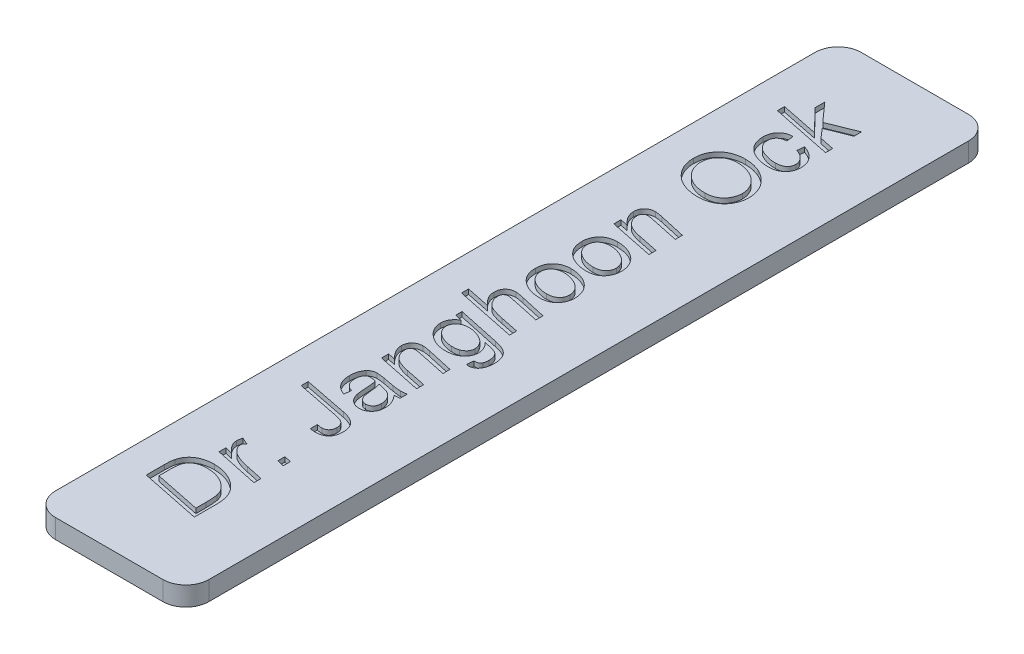
from build123d import *

# Parameters (mm, degrees)
BOSS_EXTRUDE1_DEPTH      = 66.675
BOSS_EXTRUDE1_DEPTH_BACK = 66.675
SKETCH3_W                = 25.4
SKETCH3_H                = 3.175
SKETCH5_OUTSIDE_W        = 54.556
SKETCH5_OUTSIDE_H        = 162.506
CUT_EXTRUDE2_DEPTH       = 68.947967225
CUT_EXTRUDE1_DEPTH       = 0.79375


with BuildPart() as part:
    # Sketch3 → Boss-Extrude1 (new, two sides: drawn at the far end of the back side and taken through both)
    with BuildSketch(Plane.XY.offset(-BOSS_EXTRUDE1_DEPTH_BACK)):
        Rectangle(SKETCH3_W, SKETCH3_H)
    extrude(amount=BOSS_EXTRUDE1_DEPTH + BOSS_EXTRUDE1_DEPTH_BACK)

    # Sketch5 outside → Cut-Extrude2 (cut, through all)
    with BuildSketch(Plane(origin=(0, 1.5875, 0), x_dir=(1, 0, 0), z_dir=(0, 1, 0))):
        Rectangle(SKETCH5_OUTSIDE_W, SKETCH5_OUTSIDE_H)
        with BuildLine():
            Line((12.7, -62.865), (12.7, 62.865))
            ThreePointArc((12.7, 62.865), (11.584076836, 65.559076836), (8.89, 66.675))
            Line((8.89, 66.675), (-8.89, 66.675))
            ThreePointArc((-8.89, 66.675), (-11.584076836, 65.559076836), (-12.7, 62.865))
            Line((-12.7, 62.865), (-12.7, -62.865))
            ThreePointArc((-12.7, -62.865), (-11.584076836, -65.559076836), (-8.89, -66.675))
            Line((-8.89, -66.675), (8.89, -66.675))
            ThreePointArc((8.89, -66.675), (11.584076836, -65.559076836), (12.7, -62.865))
        make_face(mode=Mode.SUBTRACT)
    extrude(amount=-CUT_EXTRUDE2_DEPTH, mode=Mode.SUBTRACT)

    # Sketch4 → Cut-Extrude1 (cut)
    # profile 1 of 14: a face of its own
    with BuildSketch(Plane(origin=(0, 1.5875, 0), x_dir=(1, 0, 0), z_dir=(0, 1, 0))):
        with BuildLine():
            Line((2.54, -55.128205128), (-7.46, -53.076923077))
            Line((-7.46, -53.076923077), (-7.46, -50.086137821))
            add(Edge.make_bspline(
                [(-7.46, -50.086137821), (-7.45984679, -49.99932217), (-7.459548547, -49.830324567), (-7.450628106, -49.585259722), (-7.439948376, -49.355355382), (-7.420380804, -49.142538387), (-7.402681558, -48.944289881), (-7.37339821, -48.762856641), (-7.342498106, -48.596212545), (-7.316265859, -48.491477372), (-7.30375, -48.44150641)],
                knots=[0, 0, 0, 0, 1.257835162, 2.448534655, 3.553053336, 4.59197352, 5.545083296, 6.435900553, 7.253741116, 8, 8, 8, 8], degree=3))
            add(Edge.make_bspline(
                [(-7.30375, -48.44150641), (-7.264998295, -48.310104018), (-7.18851271, -48.050750556), (-7.017709813, -47.687016253), (-6.807602242, -47.352185413), (-6.555874224, -47.048998786), (-6.266589713, -46.777660468), (-5.941646688, -46.542512847), (-5.584090023, -46.342580903), (-5.193365919, -46.181656045), (-4.774161856, -46.053567365), (-4.328903398, -45.962175127), (-3.858953383, -45.907209729), (-3.537875923, -45.900745857), (-3.373461538, -45.897435897)],
                knots=[0, 0, 0, 0, 0.971590842, 1.917662557, 2.842394273, 3.771793656, 4.707640625, 5.651249923, 6.612793886, 7.609543753, 8.645876517, 9.720784653, 10.832880426, 12, 12, 12, 12], degree=3))
            add(Edge.make_bspline(
                [(-3.373461538, -45.897435897), (-3.176940373, -45.901339899), (-2.791350101, -45.908999862), (-2.226265685, -45.97890124), (-1.687708416, -46.091896878), (-1.177495048, -46.252143325), (-0.695954697, -46.446012378), (-0.242926887, -46.669554868), (0.181067888, -46.918739682), (0.569448045, -47.197968419), (0.92483136, -47.490496691), (1.242239315, -47.792520822), (1.519128415, -48.102156329), (1.756689512, -48.422516984), (1.961579805, -48.760191031), (2.130416822, -49.126039248), (2.27649039, -49.518831106), (2.347494433, -49.794921946), (2.38375, -49.935897436)],
                knots=[0, 0, 0, 0, 1.243603744, 2.440050186, 3.598221513, 4.722608029, 5.820730142, 6.881240689, 7.917895811, 8.930133465, 9.905945135, 10.829761846, 11.701023769, 12.532064915, 13.351228406, 14.19647787, 15.07909869, 16, 16, 16, 16], degree=3))
            add(Edge.make_bspline(
                [(2.38375, -49.935897436), (2.407986878, -50.051813726), (2.458964214, -50.295620028), (2.507030761, -50.683954942), (2.534283451, -51.110706684), (2.538039304, -51.407541215), (2.54, -51.5625)],
                knots=[0, 0, 0, 0, 0.867572468, 1.824761937, 2.864443951, 4, 4, 4, 4], degree=3))
            Line((2.54, -51.5625), (2.54, -55.128205128))
        make_face()
        with BuildLine():
            Line((1.386153846, -53.717948718), (1.386153846, -52.067307692))
            add(Edge.make_bspline(
                [(1.386153846, -52.067307692), (1.384729604, -51.88631947), (1.381958621, -51.534191734), (1.357298812, -51.021770944), (1.319319365, -50.540400957), (1.277959754, -50.231558686), (1.257948718, -50.08213141)],
                knots=[0, 0, 0, 0, 1.090787451, 2.122218288, 3.091472141, 4, 4, 4, 4], degree=3))
            add(Edge.make_bspline(
                [(1.257948718, -50.08213141), (1.235636113, -49.995029182), (1.192149748, -49.825270465), (1.111114308, -49.582534687), (1.012809741, -49.359927124), (0.933965946, -49.223458014), (0.89536859, -49.156650641)],
                knots=[0, 0, 0, 0, 1.080723132, 2.106285617, 3.072947104, 4, 4, 4, 4], degree=3))
            add(Edge.make_bspline(
                [(0.89536859, -49.156650641), (0.841456867, -49.073439525), (0.732276862, -48.904923488), (0.538669374, -48.669689975), (0.321207629, -48.445540833), (0.161332092, -48.308727629), (0.080064103, -48.239182692)],
                knots=[0, 0, 0, 0, 0.964340652, 1.952946598, 2.95944109, 4, 4, 4, 4], degree=3))
            add(Edge.make_bspline(
                [(0.080064103, -48.239182692), (-0.033997958, -48.151637981), (-0.263964193, -47.975134701), (-0.638083185, -47.746781401), (-1.034199375, -47.543238915), (-1.454373721, -47.368350191), (-1.900405955, -47.224325254), (-2.376722172, -47.122564943), (-2.882445882, -47.062246391), (-3.22973012, -47.054994517), (-3.407516026, -47.051282051)],
                knots=[0, 0, 0, 0, 0.917646391, 1.850112875, 2.794100401, 3.759419366, 4.75327607, 5.782825037, 6.864957248, 8, 8, 8, 8], degree=3))
            add(Edge.make_bspline(
                [(-3.407516026, -47.051282051), (-3.506361982, -47.053139735), (-3.69824895, -47.056746005), (-3.977407776, -47.075391746), (-4.237981843, -47.112553399), (-4.482172146, -47.15912828), (-4.708597091, -47.223184611), (-4.917236015, -47.301717041), (-5.10991838, -47.390673969), (-5.281906949, -47.498431763), (-5.438897751, -47.614914637), (-5.581542156, -47.74016699), (-5.712747748, -47.87113119), (-5.826045089, -48.013268672), (-5.930951047, -48.158956612), (-6.014998114, -48.316644955), (-6.091451983, -48.478907462), (-6.129008394, -48.592632096), (-6.147900641, -48.649839744)],
                knots=[0, 0, 0, 0, 1.386647884, 2.691861851, 3.92103461, 5.076376283, 6.176332216, 7.216613298, 8.201138998, 9.147272505, 10.057638151, 10.940463174, 11.808053837, 12.653523594, 13.487555206, 14.321744565, 15.155776177, 16, 16, 16, 16], degree=3))
            add(Edge.make_bspline(
                [(-6.147900641, -48.649839744), (-6.161227376, -48.695751838), (-6.18938095, -48.792744057), (-6.220365305, -48.949590739), (-6.245618716, -49.123549503), (-6.267662776, -49.315276114), (-6.285960172, -49.524981726), (-6.296795208, -49.752854526), (-6.305760816, -49.99859424), (-6.306019464, -50.168259365), (-6.306153846, -50.256410256)],
                knots=[0, 0, 0, 0, 0.708240516, 1.496203126, 2.366716291, 3.313120317, 4.356013468, 5.48572228, 6.693686623, 8, 8, 8, 8], degree=3))
            Line((-6.306153846, -50.256410256), (-6.306153846, -52.139423077))
            Line((-6.306153846, -52.139423077), (1.386153846, -53.717948718))
        make_face(mode=Mode.SUBTRACT)
    # profile 2 of 14: a face of its own
    with BuildSketch(Plane(origin=(0, 1.5875, 0), x_dir=(1, 0, 0), z_dir=(0, 1, 0))):
        with BuildLine():
            Line((2.54, -45.256410256), (-4.767692308, -43.717948718))
            Line((-4.767692308, -43.717948718), (-4.767692308, -42.544070513))
            Line((-4.767692308, -42.544070513), (-3.511682692, -42.89463141))
            add(Edge.make_bspline(
                [(-3.511682692, -42.89463141), (-3.623048527, -42.797100855), (-3.835669145, -42.610894672), (-4.121593743, -42.323901052), (-4.36196178, -42.045598147), (-4.557393801, -41.773579496), (-4.709667701, -41.503661953), (-4.817284805, -41.231703196), (-4.88195118, -40.955864709), (-4.891271654, -40.770890063), (-4.895897436, -40.679086538)],
                knots=[0, 0, 0, 0, 1.317415746, 2.515221578, 3.602797499, 4.587383949, 5.492011979, 6.354026978, 7.183098174, 8, 8, 8, 8], degree=3))
            add(Edge.make_bspline(
                [(-4.895897436, -40.679086538), (-4.89418986, -40.614252592), (-4.89058847, -40.477513546), (-4.864591252, -40.262847482), (-4.824481384, -40.027518987), (-4.787234989, -39.864946846), (-4.767692308, -39.779647436)],
                knots=[0, 0, 0, 0, 0.854454067, 1.802099686, 2.846791343, 4, 4, 4, 4], degree=3))
            Line((-4.767692308, -39.779647436), (-3.613846154, -40.280448718))
            add(Edge.make_bspline(
                [(-3.613846154, -40.280448718), (-3.672264409, -40.33239109), (-3.782768762, -40.43064562), (-3.905109526, -40.604152784), (-3.984766409, -40.786095383), (-3.993917621, -40.912697996), (-3.998461538, -40.975560897)],
                knots=[0, 0, 0, 0, 1.139610882, 2.155695371, 3.084234231, 4, 4, 4, 4], degree=3))
            add(Edge.make_bspline(
                [(-3.998461538, -40.975560897), (-3.996232028, -41.029869206), (-3.991692018, -41.140458663), (-3.950925206, -41.305442925), (-3.887876765, -41.472291345), (-3.798466785, -41.640279583), (-3.685300574, -41.810874317), (-3.548161891, -41.983973837), (-3.384526612, -42.157822607), (-3.196471032, -42.335637605), (-2.974425514, -42.509115014), (-2.713352565, -42.673795941), (-2.412208671, -42.82832735), (-2.072194005, -42.976375127), (-1.693119625, -43.116599726), (-1.273504451, -43.244302663), (-0.816027311, -43.370770022), (-0.495235789, -43.441053147), (-0.328589744, -43.477564103)],
                knots=[0, 0, 0, 0, 0.549463368, 1.118886924, 1.711931635, 2.353427189, 3.042026111, 3.783708105, 4.587857209, 5.458936652, 6.403515595, 7.437581918, 8.58132111, 9.829397418, 11.192852412, 12.673529843, 14.271952167, 16, 16, 16, 16], degree=3))
            Line((-0.328589744, -43.477564103), (2.54, -44.080528846))
            Line((2.54, -44.080528846), (2.54, -45.256410256))
        make_face()
    # profile 3 of 14: a face of its own
    with BuildSketch(Plane(origin=(0, 1.5875, 0), x_dir=(1, 0, 0), z_dir=(0, 1, 0))):
        Polygon((2.54, -40.418669872), (1.386153846, -40.128205128), (1.386153846, -38.974358974), (2.54, -39.22275641), align=None)
    # profile 4 of 14: a face of its own
    with BuildSketch(Plane(origin=(0, 1.5875, 0), x_dir=(1, 0, 0), z_dir=(0, 1, 0))):
        with BuildLine():
            Line((-0.536923077, -32.852564103), (-0.536923077, -31.686698718))
            add(Edge.make_bspline(
                [(-0.536923077, -31.686698718), (-0.447596521, -31.703712534), (-0.28208303, -31.735237493), (-0.051028649, -31.764762109), (0.140912231, -31.791190929), (0.256948439, -31.793740599), (0.308429487, -31.794871795)],
                knots=[0, 0, 0, 0, 1.278457821, 2.368859001, 3.276322025, 4, 4, 4, 4], degree=3))
            add(Edge.make_bspline(
                [(0.308429487, -31.794871795), (0.395654845, -31.790822406), (0.563976465, -31.783008168), (0.802318205, -31.7179977), (1.01325682, -31.609403441), (1.192782174, -31.457105647), (1.339053195, -31.26712875), (1.441695309, -31.040233263), (1.505059891, -30.781337191), (1.511158637, -30.597349459), (1.514358974, -30.500801282)],
                knots=[0, 0, 0, 0, 1.045990313, 2.018481656, 2.940067604, 3.873194403, 4.822506759, 5.794601437, 6.842709732, 8, 8, 8, 8], degree=3))
            add(Edge.make_bspline(
                [(1.514358974, -30.500801282), (1.512248142, -30.429174199), (1.508136011, -30.289636798), (1.470452879, -30.08798599), (1.413238593, -29.898485294), (1.327944233, -29.723372595), (1.219323617, -29.561592769), (1.084286388, -29.415236957), (0.923787422, -29.283624728), (0.800404548, -29.214264289), (0.737115385, -29.178685897)],
                knots=[0, 0, 0, 0, 1.060246174, 2.065475645, 3.029247679, 3.985014274, 4.93991001, 5.906217625, 6.925995731, 8, 8, 8, 8], degree=3))
            add(Edge.make_bspline(
                [(0.737115385, -29.178685897), (0.677527127, -29.150063977), (0.541533202, -29.084742259), (0.297658357, -29.007018356), (-0.00346261, -28.922762128), (-0.226126626, -28.873053224), (-0.34661859, -28.846153846)],
                knots=[0, 0, 0, 0, 0.697358886, 1.591531234, 2.696685982, 4, 4, 4, 4], degree=3))
            Line((-0.34661859, -28.846153846), (-7.46, -27.435897436))
            Line((-7.46, -27.435897436), (-7.46, -26.280048077))
            Line((-7.46, -26.280048077), (-0.134278846, -27.716346154))
            add(Edge.make_bspline(
                [(-0.134278846, -27.716346154), (-0.012399854, -27.742257968), (0.223624223, -27.792437346), (0.56052501, -27.889215395), (0.870683465, -27.99792592), (1.15548812, -28.115587995), (1.411524518, -28.251981001), (1.643321664, -28.396568181), (1.846824336, -28.557266446), (2.022651762, -28.731891774), (2.176284494, -28.916716393), (2.307097176, -29.115601003), (2.419734067, -29.324977329), (2.509809853, -29.548424987), (2.582888961, -29.782563735), (2.631976825, -30.031058389), (2.662685957, -30.291021962), (2.666346, -30.468661683), (2.668205128, -30.558894231)],
                knots=[0, 0, 0, 0, 1.357873808, 2.629582877, 3.817375116, 4.939389344, 5.984498998, 6.975918296, 7.913708555, 8.804091746, 9.67263927, 10.528560858, 11.394695789, 12.259729077, 13.150707047, 14.064260603, 15.016736254, 16, 16, 16, 16], degree=3))
            add(Edge.make_bspline(
                [(2.668205128, -30.558894231), (2.666252982, -30.654452714), (2.662462719, -30.839987913), (2.63408404, -31.109210694), (2.588530618, -31.360535024), (2.525055263, -31.594400821), (2.441097029, -31.810404406), (2.33583894, -32.006868676), (2.215851085, -32.187972413), (2.074248027, -32.347961426), (1.917844177, -32.49140767), (1.744576988, -32.614050738), (1.556076827, -32.715869487), (1.355085714, -32.803510034), (1.13720782, -32.869314842), (0.904204845, -32.914199542), (0.656366837, -32.943023055), (0.486130209, -32.946783743), (0.398573718, -32.948717949)],
                knots=[0, 0, 0, 0, 1.219917365, 2.368576856, 3.452177122, 4.478096764, 5.458105126, 6.403956301, 7.319068094, 8.225360384, 9.124607542, 10.023531316, 10.927816313, 11.855863189, 12.818661332, 13.826892918, 14.882322605, 16, 16, 16, 16], degree=3))
            add(Edge.make_bspline(
                [(0.398573718, -32.948717949), (0.241242094, -32.944729627), (-0.073066987, -32.936761961), (-0.382420575, -32.880608964), (-0.536923077, -32.852564103)],
                knots=[0, 0, 0, 0, 1.00112681, 2, 2, 2, 2], degree=3))
        make_face()
    # profile 5 of 14: a face of its own
    with BuildSketch(Plane(origin=(0, 1.5875, 0), x_dir=(1, 0, 0), z_dir=(0, 1, 0))):
        with BuildLine():
            add(Edge.make_bspline(
                [(1.646570513, -21.153846154), (1.732878595, -21.258847786), (1.899659662, -21.461752122), (2.116861563, -21.774691507), (2.294654294, -22.082195262), (2.435677086, -22.386376552), (2.540892279, -22.692672111), (2.615727911, -23.006505416), (2.660635602, -23.330682459), (2.665668413, -23.550874404), (2.668205128, -23.661858974)],
                knots=[0, 0, 0, 0, 1.17666427, 2.273776866, 3.294363528, 4.249072144, 5.172520505, 6.09395721, 7.039286648, 8, 8, 8, 8], degree=3))
            add(Edge.make_bspline(
                [(2.668205128, -23.661858974), (2.665955036, -23.743376239), (2.661535611, -23.903485012), (2.636543435, -24.137708621), (2.589889618, -24.35951656), (2.525750529, -24.568795745), (2.443978542, -24.766881859), (2.340451899, -24.950931457), (2.222313449, -25.125483423), (2.084119782, -25.284342162), (1.932988118, -25.427714591), (1.770960633, -25.55378101), (1.598553478, -25.660375872), (1.41468304, -25.746467079), (1.221722485, -25.8153557), (1.017520379, -25.863403919), (0.803331234, -25.891303655), (0.657068572, -25.895372), (0.58286859, -25.897435897)],
                knots=[0, 0, 0, 0, 1.139398402, 2.237902362, 3.286565084, 4.301941799, 5.293235006, 6.274818073, 7.248026616, 8.233858597, 9.210773254, 10.15523883, 11.097904851, 12.037100498, 12.987448361, 13.956172875, 14.963153455, 16, 16, 16, 16], degree=3))
            add(Edge.make_bspline(
                [(0.58286859, -25.897435897), (0.485090625, -25.894941435), (0.293407255, -25.890051304), (0.016107709, -25.834520477), (-0.246211927, -25.754711018), (-0.486612226, -25.634151407), (-0.706863746, -25.488292403), (-0.905020427, -25.318358019), (-1.080464745, -25.126614958), (-1.234141064, -24.912312782), (-1.364516401, -24.673653791), (-1.473706565, -24.411300974), (-1.568082148, -24.12589731), (-1.609378929, -23.924143769), (-1.630673077, -23.820112179)],
                knots=[0, 0, 0, 0, 1.056936532, 2.072012426, 3.050446341, 4.017033365, 4.971325388, 5.904327351, 6.835479396, 7.778286282, 8.752089957, 9.772428339, 10.85138165, 12, 12, 12, 12], degree=3))
            add(Edge.make_bspline(
                [(-1.630673077, -23.820112179), (-1.637683467, -23.780766862), (-1.652845636, -23.695670261), (-1.669938705, -23.555821503), (-1.687855621, -23.394216061), (-1.706163969, -23.209981405), (-1.721985928, -23.003595175), (-1.735205106, -22.775129283), (-1.750091357, -22.524799611), (-1.760601338, -22.258907754), (-1.772987479, -21.991605595), (-1.793473145, -21.737186017), (-1.817390732, -21.502746128), (-1.844159319, -21.288657255), (-1.878930694, -21.095052742), (-1.916239062, -20.921818981), (-1.957243309, -20.767314809), (-1.992535859, -20.673508608), (-2.009278846, -20.62900641)],
                knots=[0, 0, 0, 0, 0.595113507, 1.287119793, 2.097608713, 3.016901136, 4.044304306, 5.180150922, 6.425203145, 7.779016496, 9.143236391, 10.410139865, 11.579789622, 12.652956829, 13.622514635, 14.508107769, 15.292237788, 16, 16, 16, 16], degree=3))
            add(Edge.make_bspline(
                [(-2.009278846, -20.62900641), (-2.09533164, -20.61190503), (-2.259656939, -20.579248455), (-2.495689473, -20.538980445), (-2.710069248, -20.519370304), (-2.845256422, -20.514912949), (-2.908717949, -20.512820513)],
                knots=[0, 0, 0, 0, 1.159062478, 2.213330662, 3.161275725, 4, 4, 4, 4], degree=3))
            add(Edge.make_bspline(
                [(-2.908717949, -20.512820513), (-2.982026748, -20.515452955), (-3.122553987, -20.52049914), (-3.319143144, -20.582183531), (-3.495062991, -20.675913491), (-3.585944634, -20.769838998), (-3.631875, -20.817307692)],
                knots=[0, 0, 0, 0, 1.082179195, 2.074452954, 3.026854284, 4, 4, 4, 4], degree=3))
            add(Edge.make_bspline(
                [(-3.631875, -20.817307692), (-3.661561752, -20.853333576), (-3.721585937, -20.926174965), (-3.795259024, -21.050944673), (-3.859652497, -21.185951261), (-3.909059817, -21.33439044), (-3.948875535, -21.493114107), (-3.979775134, -21.663612896), (-3.994525216, -21.846692468), (-3.997123251, -21.972469782), (-3.998461538, -22.037259615)],
                knots=[0, 0, 0, 0, 0.859677318, 1.738197206, 2.663619697, 3.613780524, 4.617262199, 5.680109423, 6.804988598, 8, 8, 8, 8], degree=3))
            add(Edge.make_bspline(
                [(-3.998461538, -22.037259615), (-3.99501423, -22.157856751), (-3.988379982, -22.389942515), (-3.915884243, -22.720311588), (-3.802513169, -23.018140455), (-3.639602404, -23.280951224), (-3.432232655, -23.506305213), (-3.1874706, -23.699452509), (-2.904130339, -23.859451646), (-2.695665541, -23.935273809), (-2.588205128, -23.974358974)],
                knots=[0, 0, 0, 0, 1.116723738, 2.149103136, 3.119662684, 4.059633705, 4.997705812, 5.945477219, 6.940924948, 8, 8, 8, 8], degree=3))
            Line((-2.588205128, -23.974358974), (-2.716410256, -25.128205128))
            add(Edge.make_bspline(
                [(-2.716410256, -25.128205128), (-2.80232055, -25.096589398), (-2.970972841, -25.0345239), (-3.21318293, -24.923725809), (-3.438818728, -24.798242475), (-3.648421087, -24.657843381), (-3.84574231, -24.509530437), (-4.024588734, -24.343019396), (-4.189821686, -24.165058675), (-4.337399606, -23.971865199), (-4.471804922, -23.767835915), (-4.581944187, -23.547052749), (-4.682787615, -23.317073652), (-4.758585383, -23.071202462), (-4.822704717, -22.814794117), (-4.861959383, -22.544267476), (-4.89291933, -22.26166088), (-4.894890311, -22.068070658), (-4.895897436, -21.969150641)],
                knots=[0, 0, 0, 0, 1.062417197, 2.085653371, 3.088515598, 4.055971998, 5.012560564, 5.950628259, 6.888695954, 7.828267707, 8.770011293, 9.71991828, 10.688895132, 11.681731345, 12.702615925, 13.754003877, 14.852349192, 16, 16, 16, 16], degree=3))
            add(Edge.make_bspline(
                [(-4.895897436, -21.969150641), (-4.894078432, -21.864906131), (-4.890525757, -21.661307352), (-4.859811901, -21.364031095), (-4.810711551, -21.083161379), (-4.740095535, -20.819194911), (-4.651242835, -20.571306365), (-4.537033321, -20.342592382), (-4.408042392, -20.127471567), (-4.304462687, -19.998257209), (-4.25286859, -19.933894231)],
                knots=[0, 0, 0, 0, 1.147245991, 2.240673226, 3.286002849, 4.282675683, 5.245377287, 6.178960641, 7.092921891, 8, 8, 8, 8], degree=3))
            add(Edge.make_bspline(
                [(-4.25286859, -19.933894231), (-4.212385001, -19.888262991), (-4.132309409, -19.798005465), (-3.998088092, -19.680114051), (-3.854377337, -19.580186139), (-3.701342618, -19.501413125), (-3.541551546, -19.434127324), (-3.370360612, -19.392748895), (-3.191595545, -19.362157702), (-3.069115272, -19.360046964), (-3.006875, -19.358974359)],
                knots=[0, 0, 0, 0, 1.030123109, 2.037559419, 3.011053403, 3.980221017, 4.942068579, 5.932871918, 6.949556441, 8, 8, 8, 8], degree=3))
            add(Edge.make_bspline(
                [(-3.006875, -19.358974359), (-2.905979995, -19.360315537), (-2.695809184, -19.363109299), (-2.369849314, -19.394418963), (-2.020140483, -19.437252878), (-1.780746511, -19.479377071), (-1.656714744, -19.501201923)],
                knots=[0, 0, 0, 0, 0.890374746, 1.854708095, 2.888508571, 4, 4, 4, 4], degree=3))
            Line((-1.656714744, -19.501201923), (0.150176282, -19.83974359))
            add(Edge.make_bspline(
                [(0.150176282, -19.83974359), (0.286895471, -19.864179777), (0.546992528, -19.910667622), (0.918574321, -19.960210266), (1.250014934, -19.993124679), (1.457537817, -19.997811763), (1.554423077, -20)],
                knots=[0, 0, 0, 0, 1.17760315, 2.240293517, 3.178453873, 4, 4, 4, 4], degree=3))
            add(Edge.make_bspline(
                [(1.554423077, -20), (1.617916936, -19.998186909), (1.757956561, -19.994188026), (1.985640302, -19.967166108), (2.25125703, -19.930287638), (2.439335815, -19.893491979), (2.54, -19.873798077)],
                knots=[0, 0, 0, 0, 0.765806568, 1.689033648, 2.76311651, 4, 4, 4, 4], degree=3))
            Line((2.54, -19.873798077), (2.54, -21.037660256))
            add(Edge.make_bspline(
                [(2.54, -21.037660256), (2.477350581, -21.050982635), (2.345315817, -21.079059785), (2.133239573, -21.110188535), (1.898028322, -21.136067182), (1.732759684, -21.147752269), (1.646570513, -21.153846154)],
                knots=[0, 0, 0, 0, 0.852048052, 1.795706417, 2.85043987, 4, 4, 4, 4], degree=3))
        make_face()
        with BuildLine():
            add(Edge.make_bspline(
                [(-1.226025641, -20.78125), (-1.193315225, -20.8620364), (-1.126713134, -21.02652661), (-1.071666969, -21.254264558), (-1.035598539, -21.474502569), (-1.006260838, -21.702335283), (-0.976555351, -21.992236162), (-0.959149109, -22.206156098), (-0.949583333, -22.323717949)],
                knots=[0, 0, 0, 0, 0.995236225, 2.026413062, 2.668910857, 3.546586138, 4.651701749, 6, 6, 6, 6], degree=3))
            add(Edge.make_bspline(
                [(-0.949583333, -22.323717949), (-0.941299233, -22.408565522), (-0.925368835, -22.571728141), (-0.896022384, -22.806545853), (-0.870163876, -23.022764256), (-0.836144319, -23.219941299), (-0.806003776, -23.399424436), (-0.770658153, -23.55998188), (-0.738742792, -23.702581607), (-0.687974584, -23.862852646), (-0.616937036, -24.041173124), (-0.50243412, -24.22674404), (-0.370751041, -24.389148363), (-0.211978436, -24.516933431), (-0.039736966, -24.616968667), (0.142425911, -24.689700333), (0.333464825, -24.736450271), (0.46440829, -24.741188084), (0.530785256, -24.743589744)],
                knots=[0, 0, 0, 0, 1.290914099, 2.482439017, 3.583655065, 4.587735824, 5.512070834, 6.33908088, 7.077314453, 7.723365281, 8.883894417, 9.97297291, 11.01390322, 12.034147283, 13.040059379, 14.020230023, 14.996428539, 16, 16, 16, 16], degree=3))
            add(Edge.make_bspline(
                [(0.530785256, -24.743589744), (0.617455058, -24.739978346), (0.786519101, -24.732933707), (1.026616904, -24.659772318), (1.242633818, -24.543383371), (1.430432075, -24.381273379), (1.585109342, -24.175893629), (1.695837405, -23.928415672), (1.759226273, -23.64229834), (1.766790351, -23.439834156), (1.770769231, -23.333333333)],
                knots=[0, 0, 0, 0, 0.97988955, 1.911439595, 2.815686549, 3.744156877, 4.700826151, 5.706792195, 6.793719898, 8, 8, 8, 8], degree=3))
            add(Edge.make_bspline(
                [(1.770769231, -23.333333333), (1.766144148, -23.229557627), (1.756872579, -23.021525967), (1.693454782, -22.712908945), (1.585189191, -22.411778273), (1.43769996, -22.121823505), (1.255534054, -21.849529444), (1.035934469, -21.608203956), (0.779358422, -21.406696684), (0.540913079, -21.267504261), (0.331057775, -21.172610381), (0.15549506, -21.104861378), (-0.035208721, -21.038685216), (-0.242781821, -20.979152662), (-0.46527188, -20.923114807), (-0.704450856, -20.871067635), (-0.959695356, -20.823340782), (-1.135808751, -20.795507858), (-1.226025641, -20.78125)],
                knots=[0, 0, 0, 0, 1.142284493, 2.289855184, 3.452396854, 4.655642366, 5.862654474, 7.048938959, 8.231436522, 9.440528665, 10.078720055, 10.765368437, 11.511603551, 12.300228438, 13.141759586, 14.037175341, 14.994511818, 16, 16, 16, 16], degree=3))
        make_face(mode=Mode.SUBTRACT)
    # profile 6 of 14: a face of its own
    with BuildSketch(Plane(origin=(0, 1.5875, 0), x_dir=(1, 0, 0), z_dir=(0, 1, 0))):
        with BuildLine():
            Line((2.54, -18.333333333), (-4.767692308, -16.834935897))
            Line((-4.767692308, -16.834935897), (-4.767692308, -15.659054487))
            Line((-4.767692308, -15.659054487), (-3.523701923, -15.915464744))
            add(Edge.make_bspline(
                [(-3.523701923, -15.915464744), (-3.638317435, -15.804982015), (-3.857226786, -15.593966054), (-4.142813456, -15.265407864), (-4.385300977, -14.954125036), (-4.575188362, -14.648049828), (-4.7177704, -14.344400884), (-4.821806667, -14.040633577), (-4.88403778, -13.731838071), (-4.89195774, -13.524575048), (-4.895897436, -13.421474359)],
                knots=[0, 0, 0, 0, 1.30312365, 2.488894821, 3.561851667, 4.531644872, 5.43189143, 6.303462422, 7.156076224, 8, 8, 8, 8], degree=3))
            add(Edge.make_bspline(
                [(-4.895897436, -13.421474359), (-4.894398014, -13.354635736), (-4.89146397, -13.223846999), (-4.86743765, -13.033233556), (-4.826377748, -12.854008345), (-4.77466013, -12.68464398), (-4.69934462, -12.529319899), (-4.614960995, -12.381406779), (-4.509303751, -12.247727969), (-4.39079191, -12.124538785), (-4.258539238, -12.015272197), (-4.115955709, -11.917478145), (-3.960937315, -11.838578802), (-3.797046198, -11.771354835), (-3.622070216, -11.718896554), (-3.435976554, -11.684274891), (-3.239816045, -11.661259573), (-3.105768738, -11.658214544), (-3.036923077, -11.656650641)],
                knots=[0, 0, 0, 0, 1.106801267, 2.165770826, 3.174582853, 4.150362596, 5.09039195, 6.027358781, 6.965304099, 7.90383602, 8.853959592, 9.80176327, 10.761365257, 11.728647482, 12.732841939, 13.78043189, 14.860046965, 16, 16, 16, 16], degree=3))
            add(Edge.make_bspline(
                [(-3.036923077, -11.656650641), (-3.001506263, -11.656776199), (-2.925863126, -11.657044366), (-2.805136991, -11.669373964), (-2.670038146, -11.68208906), (-2.520521532, -11.703138413), (-2.356833458, -11.728794054), (-2.178831041, -11.761858707), (-1.985981114, -11.796578399), (-1.853603275, -11.825789512), (-1.784919872, -11.840945513)],
                knots=[0, 0, 0, 0, 0.670266849, 1.43155415, 2.29590979, 3.240092325, 4.289873351, 5.433255951, 6.668261098, 8, 8, 8, 8], degree=3))
            Line((-1.784919872, -11.840945513), (2.54, -12.800480769))
            Line((2.54, -12.800480769), (2.54, -13.974358974))
            Line((2.54, -13.974358974), (-2.155512821, -12.986778846))
            add(Edge.make_bspline(
                [(-2.155512821, -12.986778846), (-2.262229427, -12.964787479), (-2.459801592, -12.924073272), (-2.73478674, -12.87663344), (-2.965602224, -12.849084631), (-3.104981691, -12.843178454), (-3.16713141, -12.840544872)],
                knots=[0, 0, 0, 0, 1.277367925, 2.36488355, 3.270896701, 4, 4, 4, 4], degree=3))
            add(Edge.make_bspline(
                [(-3.16713141, -12.840544872), (-3.226168605, -12.843708101), (-3.339995884, -12.849806999), (-3.503085366, -12.894570131), (-3.647724218, -12.972382581), (-3.773558141, -13.079632406), (-3.875307451, -13.216319256), (-3.947662473, -13.381183592), (-3.99210845, -13.572068635), (-3.99627106, -13.708338936), (-3.998461538, -13.780048077)],
                knots=[0, 0, 0, 0, 0.999071083, 1.926269392, 2.836772593, 3.758994104, 4.704216508, 5.69609624, 6.78762314, 8, 8, 8, 8], degree=3))
            add(Edge.make_bspline(
                [(-3.998461538, -13.780048077), (-3.996051476, -13.855631281), (-3.991270821, -14.005559803), (-3.956005778, -14.227088487), (-3.899823201, -14.442522838), (-3.821461861, -14.652391531), (-3.718766592, -14.85490113), (-3.592605586, -15.050464462), (-3.446710489, -15.240859217), (-3.276695321, -15.424821716), (-3.080043312, -15.601573746), (-2.846702444, -15.759622386), (-2.58519996, -15.911583013), (-2.290028506, -16.047847193), (-1.963714697, -16.174800753), (-1.605285087, -16.287238366), (-1.215079112, -16.39050011), (-0.942563431, -16.445735873), (-0.801346154, -16.474358974)],
                knots=[0, 0, 0, 0, 0.794211933, 1.575416444, 2.351686983, 3.131250307, 3.925369199, 4.733354975, 5.574233163, 6.443427374, 7.363177172, 8.346398859, 9.39976418, 10.539493396, 11.759447638, 13.077924296, 14.485784111, 16, 16, 16, 16], degree=3))
            Line((-0.801346154, -16.474358974), (2.54, -17.159455128))
            Line((2.54, -17.159455128), (2.54, -18.333333333))
        make_face()
    # profile 7 of 14: a face of its own
    with BuildSketch(Plane(origin=(0, 1.5875, 0), x_dir=(1, 0, 0), z_dir=(0, 1, 0))):
        with BuildLine():
            Line((3.181025641, -10.641025641), (3.309230769, -9.603365385))
            add(Edge.make_bspline(
                [(3.309230769, -9.603365385), (3.378056677, -9.604068889), (3.506653998, -9.605383346), (3.685772008, -9.587137792), (3.83793547, -9.557292922), (3.966066475, -9.508476906), (4.071640851, -9.43937215), (4.166331153, -9.359125973), (4.245045935, -9.258898817), (4.285890201, -9.183355053), (4.306826923, -9.14463141)],
                knots=[0, 0, 0, 0, 1.40684907, 2.628618036, 3.676024876, 4.571332933, 5.412498017, 6.245081265, 7.100430774, 8, 8, 8, 8], degree=3))
            add(Edge.make_bspline(
                [(4.306826923, -9.14463141), (4.331027222, -9.08706265), (4.381681858, -8.966563125), (4.430380745, -8.766278102), (4.457378188, -8.542428313), (4.461117813, -8.385497829), (4.463076923, -8.303285256)],
                knots=[0, 0, 0, 0, 0.867906831, 1.816651282, 2.856189629, 4, 4, 4, 4], degree=3))
            add(Edge.make_bspline(
                [(4.463076923, -8.303285256), (4.460890149, -8.215763845), (4.456673385, -8.046995975), (4.431888029, -7.802674299), (4.384750093, -7.57784976), (4.324573453, -7.369999211), (4.24204383, -7.182192513), (4.140387342, -7.015098261), (4.02521816, -6.862942987), (3.931065911, -6.780074646), (3.884150641, -6.738782051)],
                knots=[0, 0, 0, 0, 1.218601302, 2.349833514, 3.412658766, 4.412522724, 5.357289026, 6.257996784, 7.131974514, 8, 8, 8, 8], degree=3))
            add(Edge.make_bspline(
                [(3.884150641, -6.738782051), (3.84728306, -6.711931846), (3.767859321, -6.654088515), (3.626420684, -6.578126315), (3.45685449, -6.505908614), (3.25869984, -6.433732584), (3.03343333, -6.362435728), (2.778975505, -6.291841399), (2.496119329, -6.224769704), (2.2970522, -6.183393616), (2.193445513, -6.161858974)],
                knots=[0, 0, 0, 0, 0.607965159, 1.309737853, 2.135629831, 3.065749486, 4.122312591, 5.287340492, 6.588166385, 8, 8, 8, 8], degree=3))
            Line((2.193445513, -6.161858974), (1.610512821, -6.039663462))
            add(Edge.make_bspline(
                [(1.610512821, -6.039663462), (1.684813181, -6.116453002), (1.829941746, -6.266443605), (2.017039119, -6.508476154), (2.179128801, -6.750436143), (2.310822366, -6.997290357), (2.413757773, -7.2474621), (2.485814067, -7.50222237), (2.532515831, -7.760030841), (2.537503286, -7.933829787), (2.54, -8.020833333)],
                knots=[0, 0, 0, 0, 1.140414413, 2.227535743, 3.262035806, 4.24789823, 5.210713604, 6.145274861, 7.071526799, 8, 8, 8, 8], degree=3))
            add(Edge.make_bspline(
                [(2.54, -8.020833333), (2.537930071, -8.1077807), (2.533864829, -8.278541183), (2.494628353, -8.529199612), (2.429967973, -8.76861953), (2.342299244, -8.998428687), (2.226530588, -9.216483928), (2.085792591, -9.423080325), (1.919716231, -9.618852202), (1.729778224, -9.80268376), (1.516839666, -9.971133931), (1.279604388, -10.114985971), (1.024422158, -10.240946068), (0.745767757, -10.34022037), (0.446708604, -10.417814435), (0.12660068, -10.474167347), (-0.214458897, -10.505213175), (-0.448721835, -10.510240085), (-0.568974359, -10.512820513)],
                knots=[0, 0, 0, 0, 0.931739813, 1.829892562, 2.712152641, 3.587032103, 4.461354774, 5.352977499, 6.262360428, 7.209189796, 8.183133322, 9.166713348, 10.178551107, 11.22942935, 12.332148411, 13.48804264, 14.710554839, 16, 16, 16, 16], degree=3))
            add(Edge.make_bspline(
                [(-0.568974359, -10.512820513), (-0.669877944, -10.511655195), (-0.870752118, -10.509335335), (-1.168257925, -10.479252822), (-1.460127211, -10.436182012), (-1.745151413, -10.37367409), (-2.024301127, -10.293688643), (-2.296719898, -10.194576724), (-2.564761094, -10.081223677), (-2.822461257, -9.946882384), (-3.069158227, -9.801348839), (-3.302777117, -9.648710259), (-3.520728088, -9.489608811), (-3.721611416, -9.321801173), (-3.909254498, -9.150312166), (-4.078996126, -8.968865649), (-4.236112183, -8.783742095), (-4.374721042, -8.590366969), (-4.495734496, -8.392779417), (-4.603065245, -8.193879137), (-4.693272095, -7.99301086), (-4.768195665, -7.791186129), (-4.823549289, -7.58702096), (-4.867001071, -7.38266862), (-4.891124576, -7.175397429), (-4.894304543, -7.036648736), (-4.895897436, -6.967147436)],
                knots=[0, 0, 0, 0, 1.179645013, 2.348382542, 3.493716598, 4.628780791, 5.758351142, 6.887273402, 8.017302593, 9.159437237, 10.283161304, 11.36617585, 12.422074025, 13.436975848, 14.426193655, 15.392961743, 16.340872953, 17.26414364, 18.172262156, 19.049221799, 19.905598035, 20.745616329, 21.564122759, 22.377396674, 23.187213671, 24, 24, 24, 24], degree=3))
            add(Edge.make_bspline(
                [(-4.895897436, -6.967147436), (-4.892190358, -6.854039746), (-4.884940216, -6.632828601), (-4.823946071, -6.310809996), (-4.720420749, -6.010149872), (-4.57963687, -5.727700798), (-4.394606392, -5.467570753), (-4.169676449, -5.227984152), (-3.905511362, -5.007340944), (-3.706309491, -4.883448158), (-3.603830128, -4.819711538)],
                knots=[0, 0, 0, 0, 1.029312267, 2.013084577, 2.970597912, 3.916829657, 4.876656574, 5.866067882, 6.902199054, 8, 8, 8, 8], degree=3))
            Line((-3.603830128, -4.819711538), (-4.767692308, -4.551282051))
            Line((-4.767692308, -4.551282051), (-4.767692308, -3.501602564))
            Line((-4.767692308, -3.501602564), (2.315641026, -5.010016026))
            add(Edge.make_bspline(
                [(2.315641026, -5.010016026), (2.405934997, -5.028718243), (2.58250763, -5.065291004), (2.838129031, -5.129861323), (3.078763509, -5.197545215), (3.303302613, -5.269617577), (3.512881504, -5.345468903), (3.706645005, -5.427353795), (3.885710214, -5.513831956), (4.103270479, -5.632138067), (4.35085207, -5.801318339), (4.611898809, -6.042782551), (4.838463115, -6.319492094), (5.026049138, -6.6318146), (5.177691268, -6.97310247), (5.282625013, -7.343403568), (5.348375361, -7.738712341), (5.356396896, -8.011216983), (5.360512821, -8.151041667)],
                knots=[0, 0, 0, 0, 0.914017819, 1.787389905, 2.612997797, 3.391738568, 4.124681403, 4.821774274, 5.476067087, 6.095228776, 7.275839443, 8.437593844, 9.608945261, 10.80890108, 12.03886313, 13.300011597, 14.614610669, 16, 16, 16, 16], degree=3))
            add(Edge.make_bspline(
                [(5.360512821, -8.151041667), (5.35785719, -8.284693971), (5.3527323, -8.542618909), (5.31249044, -8.915926776), (5.245783894, -9.260960206), (5.150418732, -9.576174268), (5.029134598, -9.857840433), (4.882848859, -10.104068332), (4.708984372, -10.312009193), (4.508789175, -10.479607083), (4.288496346, -10.608249445), (4.052920458, -10.701517277), (3.801521042, -10.760007105), (3.628062067, -10.766115524), (3.539599359, -10.769230769)],
                knots=[0, 0, 0, 0, 1.33939377, 2.584789371, 3.758238772, 4.857032045, 5.879114706, 6.824919408, 7.717859736, 8.582510251, 9.428490169, 10.263678916, 11.114489951, 12, 12, 12, 12], degree=3))
            add(Edge.make_bspline(
                [(3.539599359, -10.769230769), (3.511394054, -10.767579697), (3.452699097, -10.764143832), (3.363745908, -10.737925605), (3.271170695, -10.698164693), (3.211930492, -10.66061489), (3.181025641, -10.641025641)],
                knots=[0, 0, 0, 0, 0.875924921, 1.82279098, 2.864178095, 4, 4, 4, 4], degree=3))
        make_face()
        with BuildLine():
            add(Edge.make_bspline(
                [(-0.651105769, -9.358974359), (-0.529524655, -9.356922348), (-0.302078379, -9.353083576), (0.014718481, -9.328861712), (0.284321794, -9.285494662), (0.443691901, -9.236985128), (0.516762821, -9.21474359)],
                knots=[0, 0, 0, 0, 1.234653934, 2.309712674, 3.225006173, 4, 4, 4, 4], degree=3))
            add(Edge.make_bspline(
                [(0.516762821, -9.21474359), (0.603996649, -9.178948012), (0.772805047, -9.10967908), (1.000229387, -8.972032231), (1.197119813, -8.814760809), (1.357247896, -8.633445667), (1.484492792, -8.436839083), (1.575820084, -8.227907312), (1.632514746, -8.008458238), (1.639194161, -7.858240656), (1.642564103, -7.782451923)],
                knots=[0, 0, 0, 0, 1.162419343, 2.249427205, 3.268936412, 4.261433949, 5.221681838, 6.148118799, 7.065677085, 8, 8, 8, 8], degree=3))
            add(Edge.make_bspline(
                [(1.642564103, -7.782451923), (1.636886243, -7.680421558), (1.625352383, -7.473159648), (1.537953182, -7.16535691), (1.399488501, -6.859074025), (1.239975505, -6.612348871), (1.089246139, -6.417035076), (0.956096488, -6.277244356), (0.808678911, -6.144142016), (0.646663605, -6.018225371), (0.469222075, -5.900340084), (0.278658366, -5.787347753), (0.071717244, -5.68326159), (-0.221199713, -5.558460193), (-0.591111627, -5.42163453), (-1.035333861, -5.305875654), (-1.469229518, -5.231097377), (-1.755921045, -5.221213412), (-1.897099359, -5.216346154)],
                knots=[0, 0, 0, 0, 1.019115574, 2.070205659, 3.175858525, 4.370495069, 4.998223228, 5.640551667, 6.297596932, 6.982705918, 7.690062913, 8.426321075, 9.196662839, 10.004071521, 11.60919851, 13.134660982, 14.588993069, 16, 16, 16, 16], degree=3))
            add(Edge.make_bspline(
                [(-1.897099359, -5.216346154), (-1.975261603, -5.218057835), (-2.127897491, -5.22140042), (-2.351273127, -5.242411166), (-2.561333333, -5.283200243), (-2.760013094, -5.336998514), (-2.945673548, -5.407012), (-3.120814892, -5.49160517), (-3.282272173, -5.59366949), (-3.430786031, -5.710308785), (-3.563895206, -5.836899949), (-3.680117097, -5.973165793), (-3.778026049, -6.117008998), (-3.858687692, -6.268065172), (-3.922344629, -6.426370986), (-3.964682129, -6.592882755), (-3.995257553, -6.766381398), (-3.99738173, -6.884876261), (-3.998461538, -6.945112179)],
                knots=[0, 0, 0, 0, 1.230920653, 2.403752194, 3.52762883, 4.596446815, 5.641256285, 6.647581316, 7.654016202, 8.642607244, 9.616835426, 10.541756982, 11.457488856, 12.351225293, 13.233758463, 14.136602337, 15.052756666, 16, 16, 16, 16], degree=3))
            add(Edge.make_bspline(
                [(-3.998461538, -6.945112179), (-3.995445128, -7.020175305), (-3.989404183, -7.170503706), (-3.937867633, -7.39317757), (-3.860058008, -7.613083669), (-3.748425863, -7.828351368), (-3.604664246, -8.038297727), (-3.427101337, -8.240493974), (-3.216344546, -8.435471483), (-2.975923462, -8.622413196), (-2.705669776, -8.794659822), (-2.407972286, -8.94544318), (-2.083678297, -9.070323736), (-1.746302068, -9.172843594), (-1.418436384, -9.251537238), (-1.123702698, -9.30973435), (-0.873206974, -9.350007016), (-0.71999497, -9.356192955), (-0.651105769, -9.358974359)],
                knots=[0, 0, 0, 0, 0.798730728, 1.599612497, 2.423109644, 3.278908254, 4.174660293, 5.127564016, 6.139193684, 7.229123648, 8.367734531, 9.547980458, 10.777796772, 12.064870319, 13.301906912, 14.367730838, 15.26607763, 16, 16, 16, 16], degree=3))
        make_face(mode=Mode.SUBTRACT)
    # profile 8 of 14: a face of its own
    with BuildSketch(Plane(origin=(0, 1.5875, 0), x_dir=(1, 0, 0), z_dir=(0, 1, 0))):
        with BuildLine():
            Line((2.54, -2.948717949), (-7.46, -0.897435897))
            Line((-7.46, -0.897435897), (-7.46, 0.276442308))
            Line((-7.46, 0.276442308), (-3.569775641, -0.522836538))
            add(Edge.make_bspline(
                [(-3.569775641, -0.522836538), (-3.681247962, -0.413945415), (-3.893566632, -0.20654309), (-4.176872954, 0.109888377), (-4.406188741, 0.417684779), (-4.592191227, 0.714746985), (-4.727379664, 1.011876658), (-4.826095682, 1.308934273), (-4.883068323, 1.611070513), (-4.891632902, 1.814013403), (-4.895897436, 1.915064103)],
                knots=[0, 0, 0, 0, 1.308346159, 2.491975724, 3.561779779, 4.52820385, 5.428894498, 6.295937732, 7.151501761, 8, 8, 8, 8], degree=3))
            add(Edge.make_bspline(
                [(-4.895897436, 1.915064103), (-4.894221915, 1.985893845), (-4.890941609, 2.124563101), (-4.869414756, 2.32643077), (-4.831367661, 2.516250727), (-4.777552793, 2.693683817), (-4.706643515, 2.858291379), (-4.623438549, 3.012079233), (-4.520944769, 3.150796446), (-4.407753791, 3.279884132), (-4.279445372, 3.392542534), (-4.142370836, 3.493280004), (-3.992599421, 3.573323558), (-3.836262922, 3.646526894), (-3.667017695, 3.69621625), (-3.489835833, 3.735499589), (-3.302540041, 3.757064691), (-3.174525669, 3.760342454), (-3.109038462, 3.762019231)],
                knots=[0, 0, 0, 0, 1.169014846, 2.288677241, 3.345563516, 4.35999745, 5.342562729, 6.299516235, 7.238597947, 8.183095996, 9.127594044, 10.051288484, 10.983620662, 11.925801236, 12.894862173, 13.887022083, 14.91908212, 16, 16, 16, 16], degree=3))
            add(Edge.make_bspline(
                [(-3.109038462, 3.762019231), (-3.074303479, 3.760947829), (-2.997384592, 3.758575263), (-2.872338559, 3.74837785), (-2.72738485, 3.729883654), (-2.563327557, 3.702950642), (-2.378763216, 3.671584129), (-2.174749325, 3.630431929), (-1.950073155, 3.585155436), (-1.794198882, 3.550005321), (-1.712804487, 3.531650641)],
                knots=[0, 0, 0, 0, 0.588475998, 1.303150774, 2.123698057, 3.062574761, 4.118571717, 5.294001558, 6.586982294, 8, 8, 8, 8], degree=3))
            Line((-1.712804487, 3.531650641), (2.54, 2.584134615))
            Line((2.54, 2.584134615), (2.54, 1.41025641))
            Line((2.54, 1.41025641), (-1.947179487, 2.359775641))
            add(Edge.make_bspline(
                [(-1.947179487, 2.359775641), (-2.024631926, 2.375815051), (-2.172097782, 2.406353345), (-2.382096884, 2.449612839), (-2.570319555, 2.48182819), (-2.734679049, 2.513887821), (-2.877186099, 2.535027868), (-2.996531125, 2.552353356), (-3.093600394, 2.560041986), (-3.150433201, 2.562872047), (-3.175144231, 2.564102564)],
                knots=[0, 0, 0, 0, 1.523510122, 2.900692715, 4.129268617, 5.201396799, 6.125444851, 6.903953225, 7.523436447, 8, 8, 8, 8], degree=3))
            add(Edge.make_bspline(
                [(-3.175144231, 2.564102564), (-3.232939694, 2.561997595), (-3.345205569, 2.557908759), (-3.504335266, 2.509068021), (-3.648009248, 2.434117493), (-3.773471974, 2.329114174), (-3.875272068, 2.194459637), (-3.947678432, 2.031543065), (-3.992117636, 1.842619563), (-3.996273694, 1.707662877), (-3.998461538, 1.63661859)],
                knots=[0, 0, 0, 0, 0.987354509, 1.917905174, 2.823929582, 3.749895705, 4.697389048, 5.690825337, 6.784397613, 8, 8, 8, 8], degree=3))
            add(Edge.make_bspline(
                [(-3.998461538, 1.63661859), (-3.993595983, 1.528761973), (-3.983918649, 1.31424086), (-3.912789654, 0.99608842), (-3.79540474, 0.687377321), (-3.635505395, 0.388992781), (-3.434191735, 0.11178446), (-3.194937775, -0.136741312), (-2.923072552, -0.354884177), (-2.666651965, -0.507419879), (-2.4373674, -0.615621639), (-2.23996159, -0.697885389), (-2.016336607, -0.774427813), (-1.770217098, -0.853084316), (-1.498885764, -0.928968881), (-1.202830175, -1.00248076), (-0.882251606, -1.074711926), (-0.65989043, -1.118954662), (-0.544935897, -1.141826923)],
                knots=[0, 0, 0, 0, 1.06366232, 2.115568157, 3.199742786, 4.313948853, 5.445952427, 6.568928239, 7.707946279, 8.875121279, 9.502812534, 10.208778364, 10.983907984, 11.834031498, 12.758018901, 13.763099974, 14.843585014, 16, 16, 16, 16], degree=3))
            Line((-0.544935897, -1.141826923), (2.54, -1.774839744))
            Line((2.54, -1.774839744), (2.54, -2.948717949))
        make_face()
    # profile 9 of 14: a face of its own
    with BuildSketch(Plane(origin=(0, 1.5875, 0), x_dir=(1, 0, 0), z_dir=(0, 1, 0))):
        with BuildLine():
            add(Edge.make_bspline(
                [(-0.242451923, 4.871794872), (-0.415564496, 4.875614717), (-0.75477921, 4.883099718), (-1.251970161, 4.942657388), (-1.726523818, 5.038318423), (-2.179220838, 5.17175945), (-2.608144822, 5.347473031), (-3.013991355, 5.56047946), (-3.398871352, 5.810876503), (-3.632501542, 6.008385856), (-3.750064103, 6.107772436)],
                knots=[0, 0, 0, 0, 1.091636214, 2.139065119, 3.15337043, 4.142118544, 5.111151322, 6.071929978, 7.029796406, 8, 8, 8, 8], degree=3))
            add(Edge.make_bspline(
                [(-3.750064103, 6.107772436), (-3.841664907, 6.19389871), (-4.022559085, 6.363981731), (-4.254801277, 6.652206959), (-4.455763029, 6.956812583), (-4.615583874, 7.284850972), (-4.743871893, 7.630590178), (-4.829707943, 7.997495631), (-4.886467821, 8.382979728), (-4.892705283, 8.646955915), (-4.895897436, 8.782051282)],
                knots=[0, 0, 0, 0, 1.003816656, 1.982347091, 2.950416354, 3.914638646, 4.892193557, 5.891460313, 6.920910456, 8, 8, 8, 8], degree=3))
            add(Edge.make_bspline(
                [(-4.895897436, 8.782051282), (-4.894175942, 8.887725805), (-4.890806841, 9.094539182), (-4.847175118, 9.396228324), (-4.788704215, 9.683950589), (-4.695552651, 9.953922849), (-4.583646561, 10.210488143), (-4.437892372, 10.446797227), (-4.274416064, 10.672386417), (-4.081271009, 10.876385239), (-3.870087556, 11.064464556), (-3.635869274, 11.223920663), (-3.385497823, 11.362004855), (-3.116745022, 11.473787081), (-2.829959112, 11.559972544), (-2.526200914, 11.621357136), (-2.204624282, 11.660762882), (-1.984023997, 11.664667279), (-1.871057692, 11.666666667)],
                knots=[0, 0, 0, 0, 1.074615126, 2.103106576, 3.097575643, 4.058283969, 5.004384793, 5.940349275, 6.878285767, 7.835236419, 8.793634075, 9.751332618, 10.712497606, 11.699553682, 12.707929824, 13.755599661, 14.850674129, 16, 16, 16, 16], degree=3))
            add(Edge.make_bspline(
                [(-1.871057692, 11.666666667), (-1.768175228, 11.665182923), (-1.563464817, 11.662230644), (-1.259347388, 11.636821169), (-0.960344787, 11.599506093), (-0.667036084, 11.546018334), (-0.380099087, 11.472458524), (-0.097895102, 11.386618181), (0.179860555, 11.287171614), (0.448834989, 11.168624714), (0.708105595, 11.037684582), (0.954060829, 10.893008636), (1.184021447, 10.734685665), (1.399686555, 10.564957187), (1.596876381, 10.378858142), (1.778813095, 10.180079924), (1.948693977, 9.970351437), (2.097293643, 9.745441226), (2.230805095, 9.514504011), (2.348195045, 9.279348003), (2.445422028, 9.040408803), (2.529401764, 8.799782334), (2.591178631, 8.554254826), (2.634232989, 8.305748951), (2.664697999, 8.054970651), (2.667035213, 7.886708985), (2.668205128, 7.802483974)],
                knots=[0, 0, 0, 0, 1.113738833, 2.216062143, 3.302000042, 4.375423901, 5.441518882, 6.507246096, 7.568402411, 8.633540934, 9.687580621, 10.711741633, 11.720424286, 12.708374069, 13.680161401, 14.652325156, 15.624462028, 16.598961718, 17.567435624, 18.511532561, 19.441938734, 20.358734753, 21.268778593, 22.179253087, 23.088607457, 24, 24, 24, 24], degree=3))
            add(Edge.make_bspline(
                [(2.668205128, 7.802483974), (2.66424951, 7.665979198), (2.65646131, 7.397215496), (2.586536062, 7.00404707), (2.47143836, 6.630272552), (2.3140043, 6.278626348), (2.116796248, 5.955061287), (1.878765027, 5.669014558), (1.599730828, 5.426185513), (1.286817059, 5.223798604), (0.942090387, 5.064684522), (0.56972965, 4.953449495), (0.172206488, 4.882977311), (-0.101921233, 4.87558468), (-0.242451923, 4.871794872)],
                knots=[0, 0, 0, 0, 1.056492895, 2.080124589, 3.081209678, 4.078856095, 5.056259504, 6.007075405, 6.948904615, 7.909959679, 8.884074188, 9.878700336, 10.912522586, 12, 12, 12, 12], degree=3))
        make_face()
        with BuildLine():
            add(Edge.make_bspline(
                [(-0.348621795, 6.025641026), (-0.264414711, 6.027009508), (-0.100980203, 6.029665547), (0.136481851, 6.055037576), (0.358594663, 6.091287286), (0.565062839, 6.14599992), (0.755932415, 6.215581963), (0.93155218, 6.301811989), (1.090314743, 6.404660106), (1.234062209, 6.521015133), (1.358268198, 6.651764705), (1.47097963, 6.787923078), (1.563182143, 6.935976581), (1.639345799, 7.091623901), (1.698139122, 7.256340866), (1.739518767, 7.428938248), (1.766938895, 7.609971675), (1.769478038, 7.733604939), (1.770769231, 7.796474359)],
                knots=[0, 0, 0, 0, 1.295111093, 2.513634637, 3.670576723, 4.754563163, 5.794674135, 6.791678566, 7.757713875, 8.699574419, 9.629537537, 10.528041662, 11.414483195, 12.305852245, 13.189730166, 14.099209151, 15.033418569, 16, 16, 16, 16], degree=3))
            add(Edge.make_bspline(
                [(1.770769231, 7.796474359), (1.768785723, 7.863348898), (1.76479902, 7.997761761), (1.733909092, 8.199333174), (1.681258824, 8.39966372), (1.609142373, 8.598324942), (1.516526317, 8.792747772), (1.404655442, 8.982752076), (1.267053034, 9.162504694), (1.11039183, 9.334144919), (0.939010546, 9.497458377), (0.754834316, 9.650219773), (0.557344761, 9.78864266), (0.278485876, 9.956664613), (-0.094170943, 10.140743763), (-0.410615261, 10.245427639), (-0.570977564, 10.298477564)],
                knots=[0, 0, 0, 0, 0.764356749, 1.536300352, 2.325084541, 3.129270909, 3.948818883, 4.784108857, 5.645232957, 6.531569919, 7.438703538, 8.349683677, 9.264653412, 10.192902602, 12.070703518, 14, 14, 14, 14], degree=3))
            add(Edge.make_bspline(
                [(-0.570977564, 10.298477564), (-0.684026815, 10.331736822), (-0.906184637, 10.397095985), (-1.241552637, 10.461395533), (-1.569474145, 10.504143115), (-1.786125995, 10.50995234), (-1.893092949, 10.512820513)],
                knots=[0, 0, 0, 0, 1.051458283, 2.066264747, 3.045261931, 4, 4, 4, 4], degree=3))
            add(Edge.make_bspline(
                [(-1.893092949, 10.512820513), (-1.973964531, 10.511417024), (-2.132072662, 10.50867313), (-2.361508788, 10.483463071), (-2.577980616, 10.447472478), (-2.778868205, 10.38932434), (-2.968418874, 10.321762878), (-3.141246871, 10.230949149), (-3.3029033, 10.130437719), (-3.446865877, 10.01051278), (-3.576705181, 9.881455346), (-3.690004766, 9.742699421), (-3.783675893, 9.595367855), (-3.864558787, 9.441621427), (-3.922750934, 9.27719876), (-3.967913772, 9.105891132), (-3.994442697, 8.926445673), (-3.997106683, 8.804172912), (-3.998461538, 8.741987179)],
                knots=[0, 0, 0, 0, 1.253550686, 2.450756499, 3.575994275, 4.651243888, 5.689823827, 6.690069589, 7.672416166, 8.636253265, 9.588057668, 10.508190281, 11.407164882, 12.291652033, 13.195740229, 14.104854296, 15.036162901, 16, 16, 16, 16], degree=3))
            add(Edge.make_bspline(
                [(-3.998461538, 8.741987179), (-3.994898947, 8.645611834), (-3.987868903, 8.455434871), (-3.93496654, 8.176793276), (-3.845311497, 7.911978701), (-3.72307745, 7.659043876), (-3.561784416, 7.422757035), (-3.371932438, 7.195812174), (-3.148108453, 6.982083198), (-2.895014599, 6.780053133), (-2.612730202, 6.599101053), (-2.307818635, 6.43944997), (-1.978709317, 6.310217511), (-1.635354953, 6.205902833), (-1.290402652, 6.12910722), (-0.959174561, 6.069182065), (-0.6471959, 6.033940309), (-0.445520351, 6.028334456), (-0.348621795, 6.025641026)],
                knots=[0, 0, 0, 0, 0.918900103, 1.813260755, 2.693380579, 3.579219628, 4.483615022, 5.414858147, 6.396772978, 7.43021153, 8.49899807, 9.590001927, 10.707617081, 11.866060424, 13.009348548, 14.076311867, 15.075730285, 16, 16, 16, 16], degree=3))
        make_face(mode=Mode.SUBTRACT)
    # profile 10 of 14: a face of its own
    with BuildSketch(Plane(origin=(0, 1.5875, 0), x_dir=(1, 0, 0), z_dir=(0, 1, 0))):
        with BuildLine():
            add(Edge.make_bspline(
                [(-0.242451923, 12.564102564), (-0.415564496, 12.567922409), (-0.75477921, 12.57540741), (-1.251970161, 12.63496508), (-1.726523818, 12.730626116), (-2.179220838, 12.864067143), (-2.608144822, 13.039780724), (-3.013991355, 13.252787152), (-3.398871352, 13.503184195), (-3.632501542, 13.700693549), (-3.750064103, 13.800080128)],
                knots=[0, 0, 0, 0, 1.091636214, 2.139065119, 3.15337043, 4.142118544, 5.111151322, 6.071929978, 7.029796406, 8, 8, 8, 8], degree=3))
            add(Edge.make_bspline(
                [(-3.750064103, 13.800080128), (-3.841664907, 13.886206402), (-4.022559085, 14.056289423), (-4.254801277, 14.344514652), (-4.455763029, 14.649120275), (-4.615583874, 14.977158664), (-4.743871893, 15.322897871), (-4.829707943, 15.689803323), (-4.886467821, 16.07528742), (-4.892705283, 16.339263607), (-4.895897436, 16.474358974)],
                knots=[0, 0, 0, 0, 1.003816656, 1.982347091, 2.950416354, 3.914638646, 4.892193557, 5.891460313, 6.920910456, 8, 8, 8, 8], degree=3))
            add(Edge.make_bspline(
                [(-4.895897436, 16.474358974), (-4.894175942, 16.580033497), (-4.890806841, 16.786846874), (-4.847175118, 17.088536017), (-4.788704215, 17.376258281), (-4.695552651, 17.646230541), (-4.583646561, 17.902795835), (-4.437892372, 18.139104919), (-4.274416064, 18.364694109), (-4.081271009, 18.568692932), (-3.870087556, 18.756772249), (-3.635869274, 18.916228356), (-3.385497823, 19.054312547), (-3.116745022, 19.166094773), (-2.829959112, 19.252280237), (-2.526200914, 19.313664828), (-2.204624282, 19.353070574), (-1.984023997, 19.356974972), (-1.871057692, 19.358974359)],
                knots=[0, 0, 0, 0, 1.074615126, 2.103106576, 3.097575643, 4.058283969, 5.004384793, 5.940349275, 6.878285767, 7.835236419, 8.793634075, 9.751332618, 10.712497606, 11.699553682, 12.707929824, 13.755599661, 14.850674129, 16, 16, 16, 16], degree=3))
            add(Edge.make_bspline(
                [(-1.871057692, 19.358974359), (-1.768175228, 19.357490615), (-1.563464817, 19.354538336), (-1.259347388, 19.329128862), (-0.960344787, 19.291813785), (-0.667036084, 19.238326026), (-0.380099087, 19.164766217), (-0.097895102, 19.078925873), (0.179860555, 18.979479306), (0.448834989, 18.860932406), (0.708105595, 18.729992274), (0.954060829, 18.585316329), (1.184021447, 18.426993358), (1.399686555, 18.257264879), (1.596876381, 18.071165834), (1.778813095, 17.872387616), (1.948693977, 17.66265913), (2.097293643, 17.437748918), (2.230805095, 17.206811703), (2.348195045, 16.971655695), (2.445422028, 16.732716495), (2.529401764, 16.492090026), (2.591178631, 16.246562518), (2.634232989, 15.998056643), (2.664697999, 15.747278344), (2.667035213, 15.579016677), (2.668205128, 15.494791667)],
                knots=[0, 0, 0, 0, 1.113738833, 2.216062143, 3.302000042, 4.375423901, 5.441518882, 6.507246096, 7.568402411, 8.633540934, 9.687580621, 10.711741633, 11.720424286, 12.708374069, 13.680161401, 14.652325156, 15.624462028, 16.598961718, 17.567435624, 18.511532561, 19.441938734, 20.358734753, 21.268778593, 22.179253087, 23.088607457, 24, 24, 24, 24], degree=3))
            add(Edge.make_bspline(
                [(2.668205128, 15.494791667), (2.66424951, 15.35828689), (2.65646131, 15.089523188), (2.586536062, 14.696354762), (2.47143836, 14.322580244), (2.3140043, 13.97093404), (2.116796248, 13.647368979), (1.878765027, 13.36132225), (1.599730828, 13.118493205), (1.286817059, 12.916106297), (0.942090387, 12.756992214), (0.56972965, 12.645757187), (0.172206488, 12.575285003), (-0.101921233, 12.567892372), (-0.242451923, 12.564102564)],
                knots=[0, 0, 0, 0, 1.056492895, 2.080124589, 3.081209678, 4.078856095, 5.056259504, 6.007075405, 6.948904615, 7.909959679, 8.884074188, 9.878700336, 10.912522586, 12, 12, 12, 12], degree=3))
        make_face()
        with BuildLine():
            add(Edge.make_bspline(
                [(-0.348621795, 13.717948718), (-0.264414711, 13.719317201), (-0.100980203, 13.72197324), (0.136481851, 13.747345268), (0.358594663, 13.783594978), (0.565062839, 13.838307612), (0.755932415, 13.907889655), (0.93155218, 13.994119681), (1.090314743, 14.096967799), (1.234062209, 14.213322825), (1.358268198, 14.344072398), (1.47097963, 14.480230771), (1.563182143, 14.628284274), (1.639345799, 14.783931593), (1.698139122, 14.948648558), (1.739518767, 15.12124594), (1.766938895, 15.302279367), (1.769478038, 15.425912632), (1.770769231, 15.488782051)],
                knots=[0, 0, 0, 0, 1.295111093, 2.513634637, 3.670576723, 4.754563163, 5.794674135, 6.791678566, 7.757713875, 8.699574419, 9.629537537, 10.528041662, 11.414483195, 12.305852245, 13.189730166, 14.099209151, 15.033418569, 16, 16, 16, 16], degree=3))
            add(Edge.make_bspline(
                [(1.770769231, 15.488782051), (1.768785723, 15.555656591), (1.76479902, 15.690069453), (1.733909092, 15.891640867), (1.681258824, 16.091971413), (1.609142373, 16.290632634), (1.516526317, 16.485055464), (1.404655442, 16.675059768), (1.267053034, 16.854812386), (1.11039183, 17.026452611), (0.939010546, 17.189766069), (0.754834316, 17.342527466), (0.557344761, 17.480950353), (0.278485876, 17.648972306), (-0.094170943, 17.833051455), (-0.410615261, 17.937735331), (-0.570977564, 17.990785256)],
                knots=[0, 0, 0, 0, 0.764356749, 1.536300352, 2.325084541, 3.129270909, 3.948818883, 4.784108857, 5.645232957, 6.531569919, 7.438703538, 8.349683677, 9.264653412, 10.192902602, 12.070703518, 14, 14, 14, 14], degree=3))
            add(Edge.make_bspline(
                [(-0.570977564, 17.990785256), (-0.684026815, 18.024044515), (-0.906184637, 18.089403677), (-1.241552637, 18.153703225), (-1.569474145, 18.196450808), (-1.786125995, 18.202260032), (-1.893092949, 18.205128205)],
                knots=[0, 0, 0, 0, 1.051458283, 2.066264747, 3.045261931, 4, 4, 4, 4], degree=3))
            add(Edge.make_bspline(
                [(-1.893092949, 18.205128205), (-1.973964531, 18.203724716), (-2.132072662, 18.200980822), (-2.361508788, 18.175770763), (-2.577980616, 18.13978017), (-2.778868205, 18.081632032), (-2.968418874, 18.014070571), (-3.141246871, 17.923256841), (-3.3029033, 17.822745411), (-3.446865877, 17.702820472), (-3.576705181, 17.573763038), (-3.690004766, 17.435007114), (-3.783675893, 17.287675547), (-3.864558787, 17.133929119), (-3.922750934, 16.969506452), (-3.967913772, 16.798198825), (-3.994442697, 16.618753365), (-3.997106683, 16.496480604), (-3.998461538, 16.434294872)],
                knots=[0, 0, 0, 0, 1.253550686, 2.450756499, 3.575994275, 4.651243888, 5.689823827, 6.690069589, 7.672416166, 8.636253265, 9.588057668, 10.508190281, 11.407164882, 12.291652033, 13.195740229, 14.104854296, 15.036162901, 16, 16, 16, 16], degree=3))
            add(Edge.make_bspline(
                [(-3.998461538, 16.434294872), (-3.994898947, 16.337919527), (-3.987868903, 16.147742563), (-3.93496654, 15.869100968), (-3.845311497, 15.604286393), (-3.72307745, 15.351351568), (-3.561784416, 15.115064727), (-3.371932438, 14.888119866), (-3.148108453, 14.674390891), (-2.895014599, 14.472360826), (-2.612730202, 14.291408745), (-2.307818635, 14.131757663), (-1.978709317, 14.002525203), (-1.635354953, 13.898210525), (-1.290402652, 13.821414913), (-0.959174561, 13.761489757), (-0.6471959, 13.726248001), (-0.445520351, 13.720642148), (-0.348621795, 13.717948718)],
                knots=[0, 0, 0, 0, 0.918900103, 1.813260755, 2.693380579, 3.579219628, 4.483615022, 5.414858147, 6.396772978, 7.43021153, 8.49899807, 9.590001927, 10.707617081, 11.866060424, 13.009348548, 14.076311867, 15.075730285, 16, 16, 16, 16], degree=3))
        make_face(mode=Mode.SUBTRACT)
    # profile 11 of 14: a face of its own
    with BuildSketch(Plane(origin=(0, 1.5875, 0), x_dir=(1, 0, 0), z_dir=(0, 1, 0))):
        with BuildLine():
            Line((2.54, 20.128205128), (-4.767692308, 21.626602564))
            Line((-4.767692308, 21.626602564), (-4.767692308, 22.802483974))
            Line((-4.767692308, 22.802483974), (-3.523701923, 22.546073718))
            add(Edge.make_bspline(
                [(-3.523701923, 22.546073718), (-3.638317435, 22.656556446), (-3.857226786, 22.867572408), (-4.142813456, 23.196130598), (-4.385300977, 23.507413425), (-4.575188362, 23.813488633), (-4.7177704, 24.117137577), (-4.821806667, 24.420904885), (-4.88403778, 24.72970039), (-4.89195774, 24.936963414), (-4.895897436, 25.040064103)],
                knots=[0, 0, 0, 0, 1.30312365, 2.488894821, 3.561851667, 4.531644872, 5.43189143, 6.303462422, 7.156076224, 8, 8, 8, 8], degree=3))
            add(Edge.make_bspline(
                [(-4.895897436, 25.040064103), (-4.894398014, 25.106902725), (-4.89146397, 25.237691462), (-4.86743765, 25.428304905), (-4.826377748, 25.607530117), (-4.77466013, 25.776894482), (-4.69934462, 25.932218563), (-4.614960995, 26.080131682), (-4.509303751, 26.213810492), (-4.39079191, 26.336999677), (-4.258539238, 26.446266264), (-4.115955709, 26.544060316), (-3.960937315, 26.62295966), (-3.797046198, 26.690183627), (-3.622070216, 26.742641907), (-3.435976554, 26.777263571), (-3.239816045, 26.800278888), (-3.105768738, 26.803323917), (-3.036923077, 26.804887821)],
                knots=[0, 0, 0, 0, 1.106801267, 2.165770826, 3.174582853, 4.150362596, 5.09039195, 6.027358781, 6.965304099, 7.90383602, 8.853959592, 9.80176327, 10.761365257, 11.728647482, 12.732841939, 13.78043189, 14.860046965, 16, 16, 16, 16], degree=3))
            add(Edge.make_bspline(
                [(-3.036923077, 26.804887821), (-3.001506263, 26.804762262), (-2.925863126, 26.804494095), (-2.805136991, 26.792164497), (-2.670038146, 26.779449401), (-2.520521532, 26.758400048), (-2.356833458, 26.732744408), (-2.178831041, 26.699679754), (-1.985981114, 26.664960063), (-1.853603275, 26.63574895), (-1.784919872, 26.620592949)],
                knots=[0, 0, 0, 0, 0.670266849, 1.43155415, 2.29590979, 3.240092325, 4.289873351, 5.433255951, 6.668261098, 8, 8, 8, 8], degree=3))
            Line((-1.784919872, 26.620592949), (2.54, 25.661057692))
            Line((2.54, 25.661057692), (2.54, 24.487179487))
            Line((2.54, 24.487179487), (-2.155512821, 25.474759615))
            add(Edge.make_bspline(
                [(-2.155512821, 25.474759615), (-2.262229427, 25.496750983), (-2.459801592, 25.53746519), (-2.73478674, 25.584905021), (-2.965602224, 25.612453831), (-3.104981691, 25.618360008), (-3.16713141, 25.62099359)],
                knots=[0, 0, 0, 0, 1.277367925, 2.36488355, 3.270896701, 4, 4, 4, 4], degree=3))
            add(Edge.make_bspline(
                [(-3.16713141, 25.62099359), (-3.226168605, 25.61783036), (-3.339995884, 25.611731462), (-3.503085366, 25.566968331), (-3.647724218, 25.489155881), (-3.773558141, 25.381906056), (-3.875307451, 25.245219205), (-3.947662473, 25.080354869), (-3.99210845, 24.889469826), (-3.99627106, 24.753199525), (-3.998461538, 24.681490385)],
                knots=[0, 0, 0, 0, 0.999071083, 1.926269392, 2.836772593, 3.758994104, 4.704216508, 5.69609624, 6.78762314, 8, 8, 8, 8], degree=3))
            add(Edge.make_bspline(
                [(-3.998461538, 24.681490385), (-3.996051476, 24.605907181), (-3.991270821, 24.455978658), (-3.956005778, 24.234449975), (-3.899823201, 24.019015623), (-3.821461861, 23.80914693), (-3.718766592, 23.606637331), (-3.592605586, 23.411074), (-3.446710489, 23.220679244), (-3.276695321, 23.036716746), (-3.080043312, 22.859964715), (-2.846702444, 22.701916075), (-2.58519996, 22.549955449), (-2.290028506, 22.413691269), (-1.963714697, 22.286737709), (-1.605285087, 22.174300096), (-1.215079112, 22.071038351), (-0.942563431, 22.015802589), (-0.801346154, 21.987179487)],
                knots=[0, 0, 0, 0, 0.794211933, 1.575416444, 2.351686983, 3.131250307, 3.925369199, 4.733354975, 5.574233163, 6.443427374, 7.363177172, 8.346398859, 9.39976418, 10.539493396, 11.759447638, 13.077924296, 14.485784111, 16, 16, 16, 16], degree=3))
            Line((-0.801346154, 21.987179487), (2.54, 21.302083333))
            Line((2.54, 21.302083333), (2.54, 20.128205128))
        make_face()
    # profile 12 of 14: a face of its own
    with BuildSketch(Plane(origin=(0, 1.5875, 0), x_dir=(1, 0, 0), z_dir=(0, 1, 0))):
        with BuildLine():
            add(Edge.make_bspline(
                [(-1.654711538, 32.435897436), (-1.87057238, 32.440530135), (-2.292787936, 32.449591516), (-2.911005784, 32.520012974), (-3.497358041, 32.640221172), (-4.052825503, 32.806363342), (-4.576856546, 33.018855024), (-5.068417576, 33.280476485), (-5.527940627, 33.591161616), (-5.951593542, 33.946118708), (-6.334289748, 34.334226967), (-6.668987671, 34.746923295), (-6.953905943, 35.178959118), (-7.185284667, 35.632798483), (-7.367295639, 36.105862417), (-7.495491947, 36.600371226), (-7.573140898, 37.114921109), (-7.583142286, 37.465008468), (-7.588205128, 37.642227564)],
                knots=[0, 0, 0, 0, 1.174096974, 2.296488799, 3.379330231, 4.426244142, 5.446159722, 6.450430698, 7.449854931, 8.458171054, 9.452227284, 10.410407653, 11.344354962, 12.262227522, 13.176318736, 14.096137107, 15.036238091, 16, 16, 16, 16], degree=3))
            add(Edge.make_bspline(
                [(-7.588205128, 37.642227564), (-7.585259541, 37.792012008), (-7.579476434, 38.086085622), (-7.518749595, 38.515771163), (-7.426007646, 38.924784387), (-7.293428255, 39.311869527), (-7.121250801, 39.676268115), (-6.915133938, 40.02192529), (-6.665602458, 40.342580437), (-6.38506082, 40.643148751), (-6.069970187, 40.912729396), (-5.728897894, 41.151249081), (-5.358782801, 41.349345648), (-4.96556076, 41.514727308), (-4.545636182, 41.640622356), (-4.101056882, 41.730025268), (-3.630591391, 41.785168013), (-3.308177568, 41.791585743), (-3.143092949, 41.794871795)],
                knots=[0, 0, 0, 0, 1.049132735, 2.05977501, 3.034915221, 3.985052048, 4.920858723, 5.855072614, 6.799533619, 7.762958278, 8.731970288, 9.700417098, 10.674118848, 11.668408536, 12.685488089, 13.740958229, 14.843309362, 16, 16, 16, 16], degree=3))
            add(Edge.make_bspline(
                [(-3.143092949, 41.794871795), (-3.023532211, 41.79259196), (-2.786140258, 41.78806527), (-2.433522202, 41.762694306), (-2.087298464, 41.715640299), (-1.747487639, 41.652103468), (-1.414327446, 41.570046962), (-1.08834724, 41.468684794), (-0.767885573, 41.352179298), (-0.560419687, 41.258653338), (-0.456794872, 41.211939103)],
                knots=[0, 0, 0, 0, 1.035607528, 2.056234338, 3.059809298, 4.060229902, 5.049099918, 6.029597228, 7.015825556, 8, 8, 8, 8], degree=3))
            add(Edge.make_bspline(
                [(-0.456794872, 41.211939103), (-0.306601815, 41.136856521), (-0.009850192, 40.988508265), (0.407815969, 40.727291964), (0.792183342, 40.435012511), (1.14305337, 40.117750739), (1.459999161, 39.780868131), (1.740343589, 39.43085694), (1.985218703, 39.068957519), (2.116411311, 38.814166925), (2.181426282, 38.687900641)],
                knots=[0, 0, 0, 0, 1.082752214, 2.139303144, 3.172251635, 4.193920997, 5.187331884, 6.152675788, 7.084523647, 8, 8, 8, 8], degree=3))
            add(Edge.make_bspline(
                [(2.181426282, 38.687900641), (2.220668345, 38.604267657), (2.299067226, 38.437183363), (2.395095658, 38.17850364), (2.480886113, 37.917760999), (2.548137762, 37.652457943), (2.603055215, 37.383904363), (2.640867717, 37.110926332), (2.663128391, 36.833974521), (2.666506335, 36.648010081), (2.668205128, 36.554487179)],
                knots=[0, 0, 0, 0, 1.004198862, 2.00621631, 2.998238452, 3.988025709, 4.980605787, 5.977743871, 6.982992327, 8, 8, 8, 8], degree=3))
            add(Edge.make_bspline(
                [(2.668205128, 36.554487179), (2.667087256, 36.456915951), (2.664877277, 36.264022343), (2.634505206, 35.978543069), (2.591532527, 35.699328423), (2.529345819, 35.42686659), (2.448991409, 35.161123014), (2.349915983, 34.902721623), (2.236462291, 34.64864835), (2.10204782, 34.404696093), (1.954835043, 34.169078878), (1.78950392, 33.949635944), (1.613939908, 33.7418471), (1.421277126, 33.550820374), (1.216716901, 33.371906509), (0.993776435, 33.212883105), (0.761674369, 33.062267589), (0.513927793, 32.932100508), (0.257747716, 32.81673396), (-0.00257147, 32.713810924), (-0.26752507, 32.627680053), (-0.53701793, 32.557131422), (-0.810702318, 32.503280471), (-1.089017113, 32.465714863), (-1.370457564, 32.440395549), (-1.559838528, 32.437398733), (-1.654711538, 32.435897436)],
                knots=[0, 0, 0, 0, 1.049839746, 2.075482486, 3.087049471, 4.089689785, 5.08111085, 6.073000831, 7.06705018, 8.073830201, 9.068918535, 10.055114407, 11.028894195, 11.994602189, 12.973066372, 13.95073817, 14.939759074, 15.949460052, 16.959570312, 17.96334367, 18.961231863, 19.956735488, 20.960431634, 21.961731243, 22.97890111, 24, 24, 24, 24], degree=3))
        make_face()
        with BuildLine():
            add(Edge.make_bspline(
                [(-1.602628205, 33.58974359), (-1.461430922, 33.594332922), (-1.183266243, 33.603374104), (-0.775734545, 33.675945525), (-0.385711185, 33.791693964), (-0.077418445, 33.929556223), (0.156147047, 34.061404538), (0.321933689, 34.172945835), (0.478544844, 34.294768855), (0.624437805, 34.429520481), (0.76172991, 34.57414754), (0.888067267, 34.731057406), (1.004604643, 34.899783837), (1.144265465, 35.138921521), (1.293319308, 35.450282404), (1.419249529, 35.839732412), (1.499240602, 36.238059907), (1.509304648, 36.507374224), (1.514358974, 36.642628205)],
                knots=[0, 0, 0, 0, 1.387391, 2.733219536, 4.056182661, 5.378608192, 6.043039348, 6.69121877, 7.341257155, 7.991726326, 8.641864149, 9.30007198, 9.970186554, 10.655844755, 12.021319141, 13.354099737, 14.671186335, 16, 16, 16, 16], degree=3))
            add(Edge.make_bspline(
                [(1.514358974, 36.642628205), (1.510172385, 36.773115621), (1.501852055, 37.032443234), (1.433214024, 37.416586514), (1.32099688, 37.790376861), (1.162709269, 38.152170777), (0.966819046, 38.499441115), (0.734686297, 38.830214927), (0.46732053, 39.141877034), (0.163283346, 39.431853122), (-0.172483602, 39.703297889), (-0.550972191, 39.938290823), (-0.962349091, 40.148195242), (-1.4057156, 40.320243077), (-1.862839712, 40.461812426), (-2.323666134, 40.564167898), (-2.781291462, 40.629707942), (-3.086122783, 40.637274502), (-3.23724359, 40.641025641)],
                knots=[0, 0, 0, 0, 0.910966686, 1.810433704, 2.716443525, 3.631437208, 4.562878674, 5.49713031, 6.449748591, 7.426184876, 8.428501555, 9.459840305, 10.532009948, 11.65018533, 12.777361641, 13.87163316, 14.94485739, 16, 16, 16, 16], degree=3))
            add(Edge.make_bspline(
                [(-3.23724359, 40.641025641), (-3.356227211, 40.638370092), (-3.588215602, 40.633192435), (-3.927196326, 40.591729851), (-4.248256506, 40.527397136), (-4.550075977, 40.432608831), (-4.833579538, 40.311667179), (-5.098362821, 40.163467252), (-5.344411831, 39.987616241), (-5.569899306, 39.788121842), (-5.771818028, 39.567909777), (-5.947851821, 39.333084628), (-6.100459915, 39.087491224), (-6.223278691, 38.8273617), (-6.316918789, 38.553575132), (-6.385575823, 38.268003997), (-6.426053887, 37.969909551), (-6.431561494, 37.767216677), (-6.434358974, 37.664262821)],
                knots=[0, 0, 0, 0, 1.164624597, 2.270727555, 3.33878975, 4.366469921, 5.36227511, 6.351620953, 7.331263368, 8.317775365, 9.294096208, 10.251228292, 11.187501583, 12.120413432, 13.061149964, 14.015755596, 14.992142106, 16, 16, 16, 16], degree=3))
            add(Edge.make_bspline(
                [(-6.434358974, 37.664262821), (-6.430789911, 37.531790204), (-6.423719579, 37.269361327), (-6.358612239, 36.882642657), (-6.256901364, 36.506796741), (-6.111196118, 36.144192224), (-5.927633588, 35.791489493), (-5.700126856, 35.453194467), (-5.430603959, 35.127732478), (-5.127276745, 34.814336048), (-4.786732964, 34.526876445), (-4.414193573, 34.276115735), (-4.015092693, 34.06107213), (-3.585387077, 33.89034653), (-3.129333641, 33.752818308), (-2.644881313, 33.657951662), (-2.132818407, 33.601500496), (-1.782396228, 33.593729925), (-1.602628205, 33.58974359)],
                knots=[0, 0, 0, 0, 0.901806804, 1.786483527, 2.663785466, 3.549864398, 4.443060358, 5.367817799, 6.321251639, 7.318441786, 8.335346413, 9.350958156, 10.372562359, 11.417446417, 12.495354215, 13.613142793, 14.775532412, 16, 16, 16, 16], degree=3))
        make_face(mode=Mode.SUBTRACT)
    # profile 13 of 14: a face of its own
    with BuildSketch(Plane(origin=(0, 1.5875, 0), x_dir=(1, 0, 0), z_dir=(0, 1, 0))):
        with BuildLine():
            Line((-0.152307692, 47.307692308), (-0.024102564, 48.461538462))
            add(Edge.make_bspline(
                [(-0.024102564, 48.461538462), (0.086575197, 48.422104962), (0.302915524, 48.345024831), (0.611838024, 48.210123376), (0.899131636, 48.064165981), (1.164566157, 47.906027757), (1.407802738, 47.734714274), (1.631716125, 47.553628074), (1.82982257, 47.35609402), (2.007021653, 47.148852174), (2.16371448, 46.932775091), (2.298200277, 46.707097091), (2.412896323, 46.474944694), (2.505830353, 46.234190305), (2.577224741, 45.9866601), (2.629808842, 45.731583262), (2.66303054, 45.469632533), (2.666471128, 45.291898662), (2.668205128, 45.202323718)],
                knots=[0, 0, 0, 0, 1.240566549, 2.424918714, 3.557168939, 4.642022354, 5.684825849, 6.697040216, 7.679409172, 8.634778597, 9.574269363, 10.494641324, 11.406108526, 12.305823581, 13.216390057, 14.123673624, 15.054362412, 16, 16, 16, 16], degree=3))
            add(Edge.make_bspline(
                [(2.668205128, 45.202323718), (2.66594912, 45.106729314), (2.661515103, 44.918845563), (2.625158107, 44.644348725), (2.564451671, 44.384413515), (2.48298858, 44.137112403), (2.373381915, 43.905138585), (2.244105201, 43.684200975), (2.084751939, 43.482000752), (1.907635797, 43.29092722), (1.707737192, 43.119163333), (1.487726157, 42.969153508), (1.246612936, 42.845517409), (0.98827341, 42.740681853), (0.71023859, 42.660763751), (0.413711896, 42.605577462), (0.098909076, 42.570982978), (-0.117493234, 42.566434362), (-0.228429487, 42.564102564)],
                knots=[0, 0, 0, 0, 1.03650477, 2.037173682, 2.996310351, 3.928381449, 4.855006824, 5.774073815, 6.69823389, 7.64096301, 8.596127175, 9.55022005, 10.521959611, 11.529210567, 12.569730121, 13.653431089, 14.797057381, 16, 16, 16, 16], degree=3))
            add(Edge.make_bspline(
                [(-0.228429487, 42.564102564), (-0.425733273, 42.570031143), (-0.820284302, 42.581886602), (-1.408932524, 42.67363032), (-1.991976361, 42.822064474), (-2.467081717, 42.994945856), (-2.83560791, 43.158762865), (-3.09680045, 43.297102562), (-3.340281697, 43.44952593), (-3.568763284, 43.611445161), (-3.777810809, 43.789055173), (-3.970313424, 43.97898967), (-4.145128521, 44.18251342), (-4.303317999, 44.396642665), (-4.444498033, 44.621068283), (-4.563690548, 44.855896235), (-4.666700675, 45.09729762), (-4.751481711, 45.346147225), (-4.815119226, 45.603680771), (-4.861063104, 45.868753783), (-4.889880168, 46.14186299), (-4.893875464, 46.326718984), (-4.895897436, 46.420272436)],
                knots=[0, 0, 0, 0, 1.746951734, 3.493402836, 5.263487425, 7.068878092, 7.963628924, 8.834066116, 9.684153061, 10.506422436, 11.312148058, 12.110919464, 12.899310907, 13.685925692, 14.467051932, 15.24470005, 16.015843941, 16.790133846, 17.570453646, 18.36289422, 19.171479953, 20, 20, 20, 20], degree=3))
            add(Edge.make_bspline(
                [(-4.895897436, 46.420272436), (-4.89424166, 46.51585615), (-4.891001269, 46.702915691), (-4.857894122, 46.97558205), (-4.80630167, 47.23298213), (-4.734922062, 47.47516), (-4.639352803, 47.700682738), (-4.525882556, 47.912692057), (-4.387778264, 48.107638964), (-4.23214419, 48.288233817), (-4.058296164, 48.449399544), (-3.870633338, 48.591964356), (-3.667612373, 48.709765261), (-3.451713821, 48.805917139), (-3.223382793, 48.883490839), (-2.980810752, 48.936304718), (-2.724679294, 48.969462348), (-2.549582449, 48.972701679), (-2.46, 48.974358974)],
                knots=[0, 0, 0, 0, 1.150902079, 2.252342023, 3.302915757, 4.310616365, 5.287577295, 6.248547387, 7.20137051, 8.159306271, 9.115416811, 10.051664259, 10.992495691, 11.935765092, 12.894679631, 13.891860548, 14.921440904, 16, 16, 16, 16], degree=3))
            Line((-2.46, 48.974358974), (-2.331794872, 47.820512821))
            add(Edge.make_bspline(
                [(-2.331794872, 47.820512821), (-2.395302152, 47.818936469), (-2.51936828, 47.81585695), (-2.699463691, 47.793042134), (-2.869005497, 47.759317613), (-3.02786115, 47.713123644), (-3.177375261, 47.655437531), (-3.315486209, 47.583107328), (-3.443532548, 47.498360118), (-3.55892811, 47.400016816), (-3.662743747, 47.292996112), (-3.7524299, 47.176533194), (-3.828672544, 47.052471058), (-3.890993629, 46.91939394), (-3.939439062, 46.778343296), (-3.97265816, 46.628450106), (-3.996211281, 46.471094816), (-3.997704401, 46.362937714), (-3.998461538, 46.308092949)],
                knots=[0, 0, 0, 0, 1.200707495, 2.345670123, 3.427913376, 4.466931974, 5.470586912, 6.453370225, 7.409506858, 8.368308221, 9.314975018, 10.224267012, 11.142546134, 12.063339787, 12.997799767, 13.956601131, 14.96382456, 16, 16, 16, 16], degree=3))
            add(Edge.make_bspline(
                [(-3.998461538, 46.308092949), (-3.996789514, 46.243929712), (-3.993487838, 46.117229315), (-3.97123529, 45.930157165), (-3.933748338, 45.749573813), (-3.878209551, 45.575863831), (-3.810803547, 45.408016773), (-3.728640314, 45.246465773), (-3.628675075, 45.093112386), (-3.515027577, 44.945576576), (-3.386193783, 44.803573435), (-3.239205719, 44.672588379), (-3.078423411, 44.547265212), (-2.900719616, 44.431626168), (-2.709475662, 44.321162914), (-2.500611175, 44.221064997), (-2.277346299, 44.127354645), (-1.961695778, 44.013955949), (-1.559613403, 43.897878675), (-1.078361757, 43.795430908), (-0.606193378, 43.729466822), (-0.294071849, 43.721750552), (-0.140288462, 43.717948718)],
                knots=[0, 0, 0, 0, 0.746009167, 1.47311238, 2.187291442, 2.887146252, 3.590737999, 4.288695244, 4.990786017, 5.7160214, 6.452433626, 7.216526376, 8.002360803, 8.820663914, 9.679686762, 10.568644365, 11.511698096, 12.494106191, 14.467143053, 16.372156823, 18.212548769, 20, 20, 20, 20], degree=3))
            add(Edge.make_bspline(
                [(-0.140288462, 43.717948718), (-0.062784757, 43.718869074), (0.087162009, 43.72064969), (0.304101137, 43.740888396), (0.50582918, 43.774436717), (0.692598893, 43.822790993), (0.865086863, 43.88238362), (1.023926797, 43.954276823), (1.165927351, 44.042735582), (1.292963344, 44.14362156), (1.40461846, 44.254075777), (1.503523795, 44.370004416), (1.587103321, 44.493210473), (1.652250753, 44.623918887), (1.705618951, 44.759772827), (1.743420852, 44.901492691), (1.765946117, 45.05003098), (1.769138403, 45.150829345), (1.770769231, 45.202323718)],
                knots=[0, 0, 0, 0, 1.365122578, 2.641108781, 3.834423656, 4.964353964, 6.035880282, 7.046520674, 8.029179665, 8.975388603, 9.898797543, 10.792037468, 11.656698249, 12.514287335, 13.359767909, 14.22442869, 15.092922488, 16, 16, 16, 16], degree=3))
            add(Edge.make_bspline(
                [(1.770769231, 45.202323718), (1.764715672, 45.306402321), (1.75251074, 45.516241241), (1.659999056, 45.826167748), (1.505206006, 46.125382909), (1.333265386, 46.363713608), (1.168689325, 46.547904837), (1.025568775, 46.680291056), (0.86698704, 46.8042081), (0.693198473, 46.920592433), (0.50549163, 47.031556774), (0.299387857, 47.130476711), (0.079936981, 47.225340033), (-0.073837037, 47.279867183), (-0.152307692, 47.307692308)],
                knots=[0, 0, 0, 0, 1.229103891, 2.478067788, 3.787635444, 5.196035623, 5.93934575, 6.704461841, 7.497092147, 8.315818666, 9.175412666, 10.072004748, 11.016146849, 12, 12, 12, 12], degree=3))
        make_face()
    # profile 14 of 14: a face of its own
    with BuildSketch(Plane(origin=(0, 1.5875, 0), x_dir=(1, 0, 0), z_dir=(0, 1, 0))):
        Polygon((2.54, 49.358974359), (-7.46, 51.392227564), (-7.46, 52.564102564), (-1.20599359, 51.294070513), (-4.767692308, 54.907852564), (-4.767692308, 56.538461538), (-2.017291667, 53.459535256), (2.54, 55.302483974), (2.54, 54.068509615), (-1.207996795, 52.554086538), (0.098092949, 51.041666667), (2.54, 50.532852564), align=None)
    extrude(amount=-CUT_EXTRUDE1_DEPTH, mode=Mode.SUBTRACT)


solid = part.part
